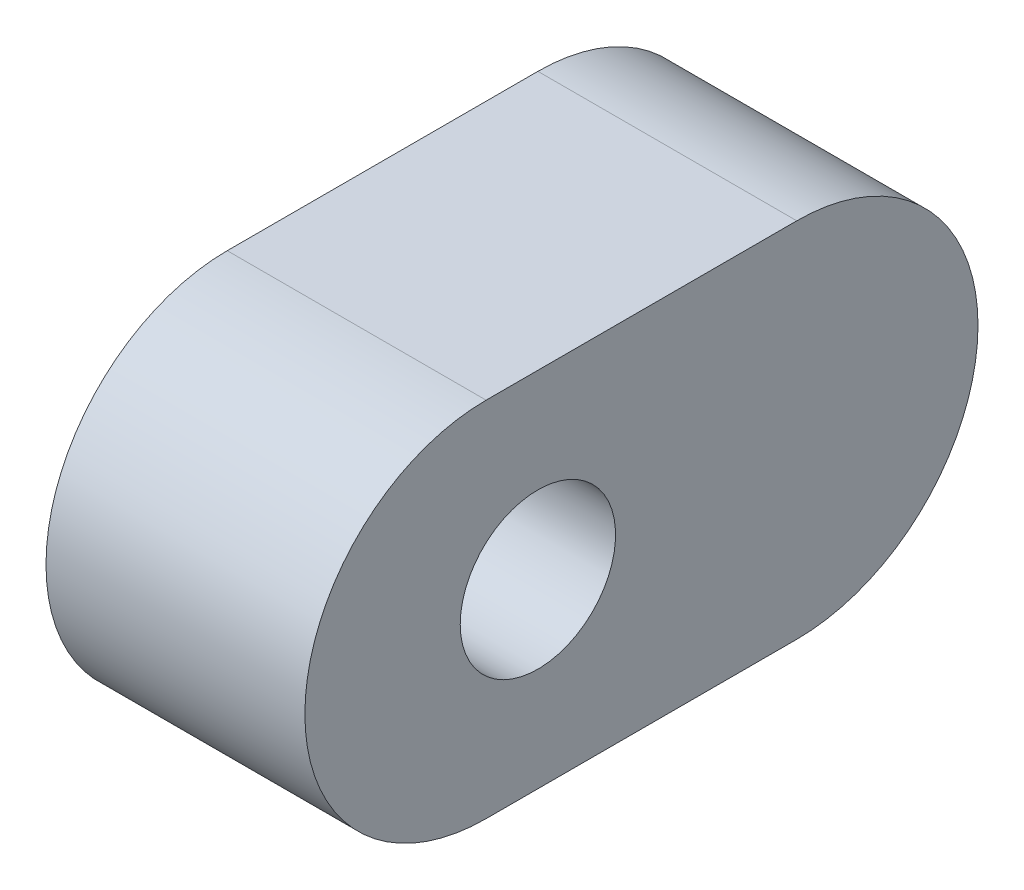
from build123d import *

# Parameters (mm, degrees)
SKETCH1_R           = 1.905
BOSS_EXTRUDE1_DEPTH = 6.35
BOSS_EXTRUDE2_START = -6.35
BOSS_EXTRUDE2_DEPTH = 6.35
BOSS_EXTRUDE4_START = -6.35
SKETCH6_R           = 1.905
BOSS_EXTRUDE4_DEPTH = 6.35
SKETCH7_R           = 1.905
CUT_EXTRUDE3_DEPTH  = 15.340319034
SKETCH8_R           = 3.048
CUT_EXTRUDE4_DEPTH  = 2.54


with BuildPart() as part:
    # Sketch1 → Boss-Extrude1 (new body)
    with BuildSketch(Plane.YZ):
        with BuildLine():
            Line((-3.175, 0), (-3.175, -7.62))
            ThreePointArc((-3.175, -7.62), (0, -10.795), (3.175, -7.62))
            Line((3.175, -7.62), (3.175, 0))
            ThreePointArc((3.175, 0), (0, 3.175), (-3.175, 0))
        make_face()
        with Locations(Location((0, 0, 0), (0, 0, 270))):
            Circle(SKETCH1_R, mode=Mode.SUBTRACT)
    extrude(amount=BOSS_EXTRUDE1_DEPTH)

    # Sketch2 → Boss-Extrude2 (add)
    with BuildSketch(Plane.YZ.offset(6.35).offset(BOSS_EXTRUDE2_START)):
        with BuildLine():
            Line((4.445, -7.62), (4.445, 0))
            ThreePointArc((4.445, 0), (0, 4.445), (-4.445, 0))
            Line((-4.445, 0), (-4.445, -7.62))
            ThreePointArc((-4.445, -7.62), (0, -12.065), (4.445, -7.62))
        make_face()
        with BuildLine():
            ThreePointArc((3.175, 0), (0, 3.175), (-3.175, 0))
            Line((-3.175, 0), (-3.175, -7.62))
            ThreePointArc((-3.175, -7.62), (0, -10.795), (3.175, -7.62))
            Line((3.175, -7.62), (3.175, 0))
        make_face(mode=Mode.SUBTRACT)
    extrude(amount=BOSS_EXTRUDE2_DEPTH)

    # Sketch6 → Boss-Extrude4 (add)
    with BuildSketch(Plane.YZ.offset(6.35).offset(BOSS_EXTRUDE4_START)):
        Circle(SKETCH6_R)
    extrude(amount=BOSS_EXTRUDE4_DEPTH)

    # Sketch7 → Cut-Extrude3 (cut, through all)
    with BuildSketch(Plane(origin=(0, 0, 0), x_dir=(0, -1, 0), z_dir=(-1, 0, 0))):
        with Locations(Location((0, -1.27, 0), (0, 0, 90))):
            Circle(SKETCH7_R)
    extrude(amount=-CUT_EXTRUDE3_DEPTH, mode=Mode.SUBTRACT)

    # Sketch8 → Cut-Extrude4 (cut)
    with BuildSketch(Plane(origin=(0, 0, 0), x_dir=(0, -1, 0), z_dir=(-1, 0, 0))):
        with Locations(Location((0, -1.27, 0), (0, 0, 90))):
            Circle(SKETCH8_R)
    extrude(amount=-CUT_EXTRUDE4_DEPTH, mode=Mode.SUBTRACT)


solid = part.part
